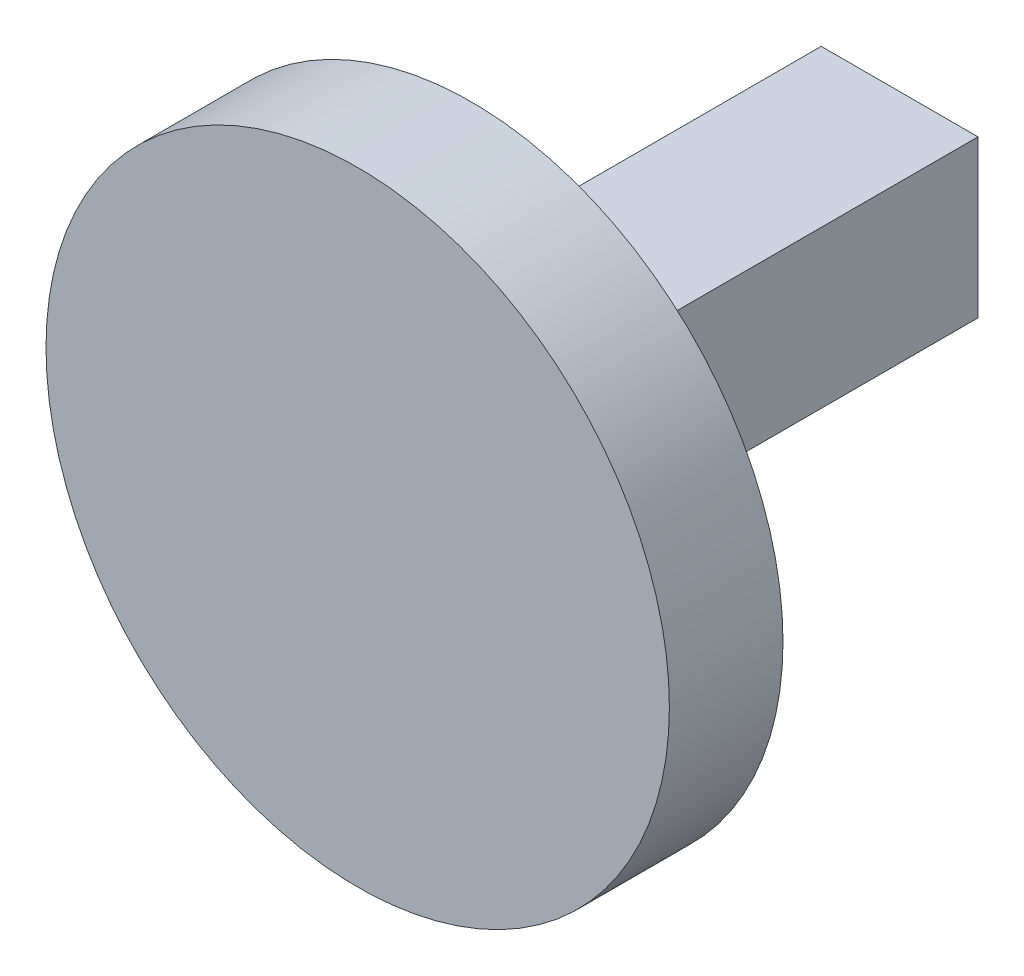
from build123d import *

# Parameters (mm, degrees)
BOSS_EXTRUDE1_START = -5
SKETCH1_R           = 13.717927936
BOSS_EXTRUDE1_DEPTH = 5
SKETCH2_W           = 6.9
SKETCH2_H           = 6.9
BOSS_EXTRUDE2_DEPTH = 20


with BuildPart() as part:
    # Sketch1 → Boss-Extrude1 (new body)
    with BuildSketch(Plane.XY.offset(BOSS_EXTRUDE1_START)):
        with Locations((1.150128538, -20.08136278)):
            Circle(SKETCH1_R)
    extrude(amount=-BOSS_EXTRUDE1_DEPTH)

    # Sketch2 → Boss-Extrude2 (add)
    with BuildSketch(Plane(origin=(0, 0, -10), x_dir=(-1, 0, 0), z_dir=(0, 0, -1))):
        with Locations((0, -20)):
            Rectangle(SKETCH2_W, SKETCH2_H)
    extrude(amount=BOSS_EXTRUDE2_DEPTH)


solid = part.part
